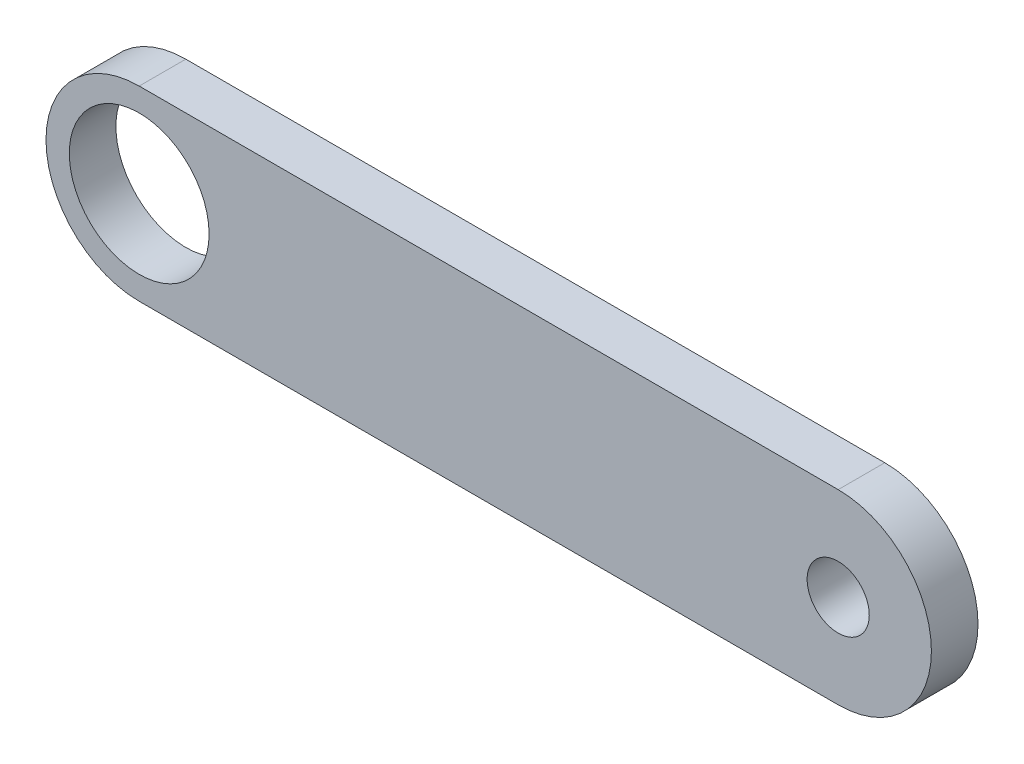
from build123d import *

# Parameters (mm, degrees)
SKETCH_1_R      = 4.5
SKETCH_1_R_2    = 2
EXTRUDE_1_DEPTH = 3


with BuildPart() as part:
    # 草图1 → 凸台-拉伸1 (new body)
    with BuildSketch(Plane.XY):
        with BuildLine():
            Line((0, 6), (45, 6))
            ThreePointArc((45, 6), (51, 0), (45, -6))
            Line((45, -6), (0, -6))
            ThreePointArc((0, -6), (-6, 0), (0, 6))
        make_face()
        Circle(SKETCH_1_R, mode=Mode.SUBTRACT)
        with Locations((45, 0)):
            Circle(SKETCH_1_R_2, mode=Mode.SUBTRACT)
    extrude(amount=EXTRUDE_1_DEPTH)


solid = part.part
